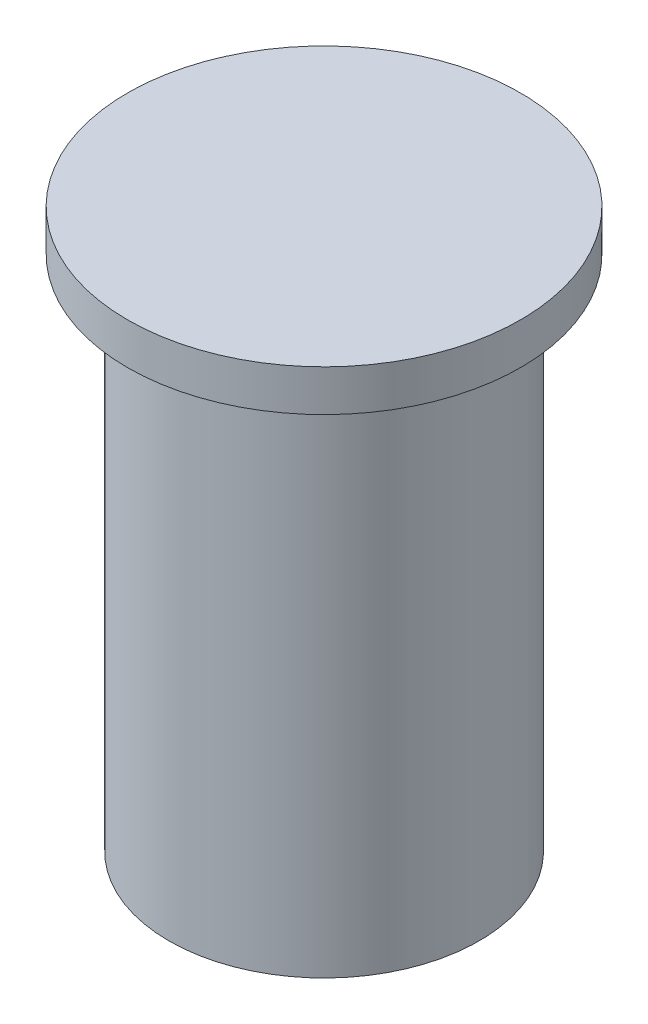
from build123d import *


with BuildPart() as part:
    # Sketch1 → Revolve1 (revolve)
    with BuildSketch(Plane(origin=(0, 0, 0), x_dir=(0, 0, -1), z_dir=(1, 0, 0))):
        Polygon((0, 0.4), (0, -5), (-1.5, -5), (-1.5, 0), (-1.9, 0), (-1.9, 0.4), align=None)
    revolve(axis=Axis((0, 0.4, 0), (0, -1, 0)))


solid = part.part
